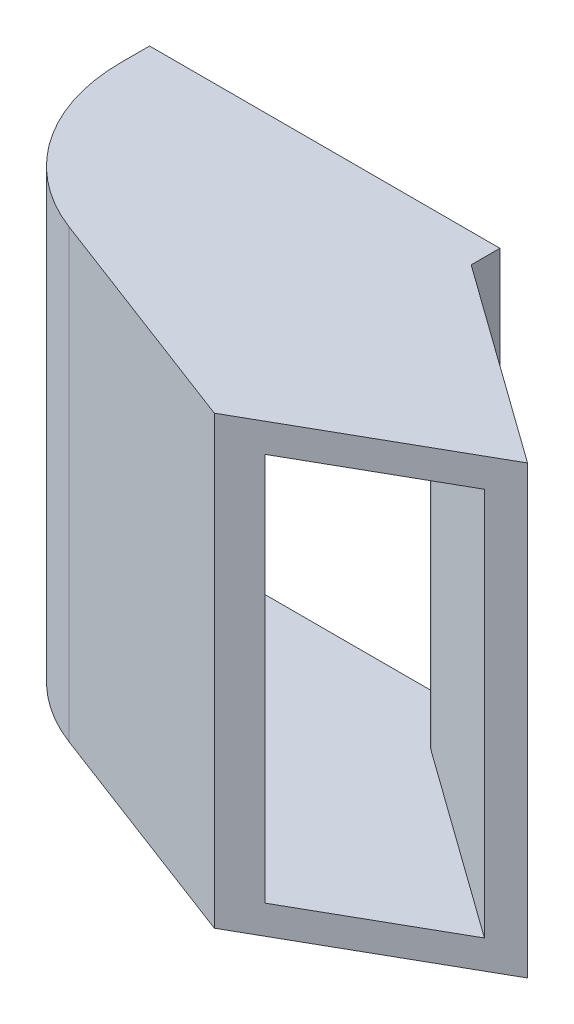
from build123d import *

# Parameters (mm, degrees)
EXTRUDE_2_DEPTH     = 23.3
CUT_EXTRUDE_1_DEPTH = 20.3
SKETCH_5_W          = 18.3
SKETCH_5_H          = 23.3
SKETCH_5_W_2        = 15.3
SKETCH_5_H_2        = 20.3
EXTRUDE_3_DEPTH     = 1.5


with BuildPart() as part:
    # 草圖3 → 填料-伸長2 (new body)
    with BuildSketch(Plane(origin=(0, 0, 0), x_dir=(1, 0, 0), z_dir=(0, 1, 0))):
        with BuildLine():
            Line((-1.5, 0), (16.8, 0))
            Line((16.8, 0), (27.234104494, -7.490738748))
            Line((27.234104494, -7.490738748), (16.8, -13.417750086))
            Line((16.8, -13.417750086), (4.557217445, -8.775105803))
            ThreePointArc((4.557217445, -8.775105803), (0.161354932, -5.331331096), (-1.5, 0))
        make_face()
    extrude(amount=-EXTRUDE_2_DEPTH)

    # 草圖4 → 除料-伸長1 (cut)
    with BuildSketch(Plane(origin=(0, -1.5, 0), x_dir=(1, 0, 0), z_dir=(0, 1, 0))):
        with BuildLine():
            Line((25.798187114, -8.30640037), (15.925221667, -1.21850846))
            ThreePointArc((15.925221667, -1.21850846), (15.465427503, -0.684774598), (15.3, 0))
            Line((15.3, 0), (0, 0))
            ThreePointArc((0, 0), (1.395817627, -4.479214992), (5.089081639, -7.37256508))
            Line((5.089081639, -7.37256508), (18.493554713, -12.455739595))
            Line((18.493554713, -12.455739595), (25.798187114, -8.30640037))
        make_face()
    extrude(amount=-CUT_EXTRUDE_1_DEPTH, mode=Mode.SUBTRACT)

    # 草圖5 → 填料-伸長3 (add)
    with BuildSketch(Plane(origin=(0, 0, 0), x_dir=(-1, 0, 0), z_dir=(0, 0, -1))):
        with Locations((-7.65, -11.65)):
            Rectangle(SKETCH_5_W, SKETCH_5_H)
        with Locations((-7.65, -11.65)):
            Rectangle(SKETCH_5_W_2, SKETCH_5_H_2, mode=Mode.SUBTRACT)
    extrude(amount=EXTRUDE_3_DEPTH)


solid = part.part
